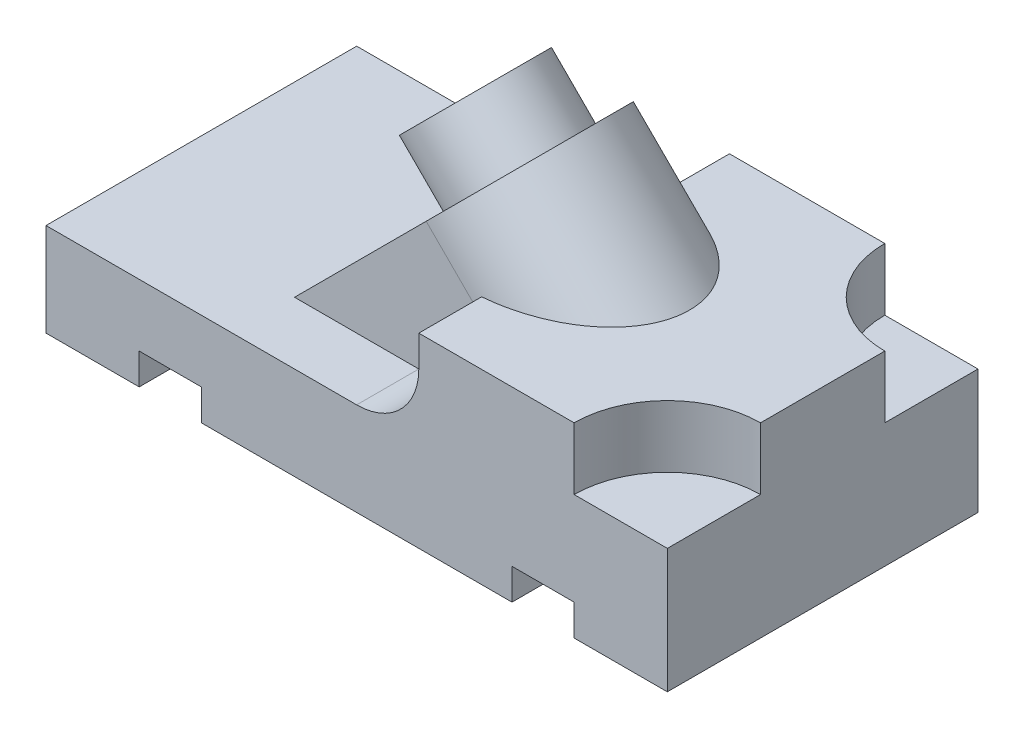
from build123d import *

# Parameters (mm, degrees)
BOSS_EXTRUDE1_DEPTH = 50
BOSS_EXTRUDE2_REACH = 113.636
SKETCH3_R           = 10
SKETCH3_R_2         = 5
BOSS_EXTRUDE3_DEPTH = 10
SKETCH4_R           = 15
CUT_EXTRUDE1_DEPTH  = 10
SKETCH5_W           = 10
SKETCH5_H           = 5
CUT_EXTRUDE2_DEPTH  = 123.609341231


with BuildPart() as part:
    # Sketch1 → Boss-Extrude1 (new body)
    with BuildSketch(Plane.XY):
        with BuildLine():
            Line((0, 0), (0, 15))
            Line((0, 15), (50, 15))
            ThreePointArc((50, 15), (57.071067812, 17.928932188), (60, 25))
            Line((60, 25), (60, 30))
            Line((60, 30), (100, 30))
            Line((100, 30), (100, 0))
            Line((100, 0), (0, 0))
        make_face()
    extrude(amount=BOSS_EXTRUDE1_DEPTH)

    # Sketch2 → Boss-Extrude2 (add, up to next)
    with BuildSketch(Plane(origin=(7.5, -7.5, 0), x_dir=(0, 0, 1), z_dir=(-0.7071067811865488, 0.7071067811865464, 0)), mode=Mode.PRIVATE) as boss_extrude2_sk1:
        with BuildLine():
            Line((10, 31.783150625), (40, 31.783150625))
            Line((40, 31.783150625), (40, 61.783150625))
            ThreePointArc((40, 61.783150625), (25, 76.783150625), (10, 61.783150625))
            Line((10, 61.783150625), (10, 31.783150625))
        make_face()
    boss_extrude2_tool1 = extrude(boss_extrude2_sk1.sketch, amount=-BOSS_EXTRUDE2_REACH, mode=Mode.PRIVATE) - part.part
    add(boss_extrude2_tool1.solids().sort_by_distance((44.840734, 29.840734, 25))[0])

    # Sketch3 → Boss-Extrude3 (add)
    with BuildSketch(Plane(origin=(7.5, -7.5, 0), x_dir=(0, 0, 1), z_dir=(-0.7071067811865486, 0.7071067811865465, 0))):
        with Locations((25, 61.783150625)):
            Circle(SKETCH3_R)
        with Locations((25, 61.783150625)):
            Circle(SKETCH3_R_2, mode=Mode.SUBTRACT)
    extrude(amount=BOSS_EXTRUDE3_DEPTH)

    # Sketch4 → Cut-Extrude1 (cut)
    with BuildSketch(Plane(origin=(0, 30, 0), x_dir=(1, 0, 0), z_dir=(0, 1, 0))):
        with Locations((100, 0)):
            Circle(SKETCH4_R)
        with Locations((100, -50)):
            Circle(SKETCH4_R)
    extrude(amount=-CUT_EXTRUDE1_DEPTH, mode=Mode.SUBTRACT)

    # Sketch5 → Cut-Extrude2 (cut, through all)
    with BuildSketch(Plane.XY.offset(50)):
        with Locations((80, 2.5)):
            Rectangle(SKETCH5_W, SKETCH5_H)
        with Locations((20, 2.5)):
            Rectangle(SKETCH5_W, SKETCH5_H)
    extrude(amount=-CUT_EXTRUDE2_DEPTH, mode=Mode.SUBTRACT)


solid = part.part
